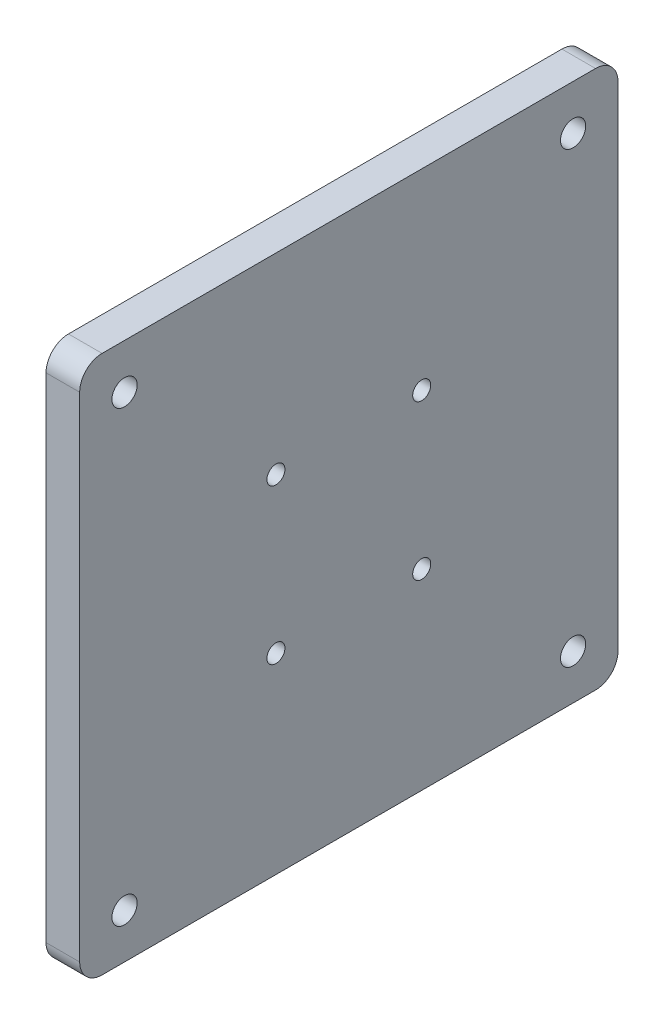
from build123d import *

# Parameters (mm, degrees)
SKETCH1_W               = 152.4
SKETCH1_H               = 152.4
BOSS_EXTRUDE1_DEPTH     = 9.525
F_1_4_20_TAPPED_HOLE1_D = 5.1054
FILLET1_R               = 6.35
F_1_4_CLEARANCE_HOLE1_D = 7.14248


with BuildPart() as part:
    # Sketch1 → Boss-Extrude1 (new body)
    with BuildSketch(Plane(origin=(0, 0, 0), x_dir=(0, 0, -1), z_dir=(1, 0, 0))):
        Rectangle(SKETCH1_W, SKETCH1_H)
    extrude(amount=BOSS_EXTRUDE1_DEPTH)

    # 1/4-20 Tapped Hole1 (through all)
    with Locations(Plane(origin=(9.525, 0, 0), x_dir=(0, 0, -1), z_dir=(1, 0, 0))):
        with Locations((-20.6375, 21.9075), (20.6375, 21.9075), (20.6375, -21.9075), (-20.6375, -21.9075)):
            Hole(F_1_4_20_TAPPED_HOLE1_D / 2)

    # Fillet1
    fillet1_edges = [part.edges().sort_by_distance(p)[0] for p in [
        (4.7625, -76.2, 76.2),
        (4.7625, -76.2, -76.2),
        (4.7625, 76.2, -76.2),
        (4.7625, 76.2, 76.2),
    ]]
    fillet(fillet1_edges, radius=FILLET1_R)

    # 1/4 Clearance Hole1 (through all)
    with Locations(Plane(origin=(9.525, 0, 0), x_dir=(0, 0, -1), z_dir=(1, 0, 0))):
        with Locations((-63.5, 63.5), (63.5, 63.5), (63.5, -63.5), (-63.5, -63.5)):
            Hole(F_1_4_CLEARANCE_HOLE1_D / 2)


solid = part.part
